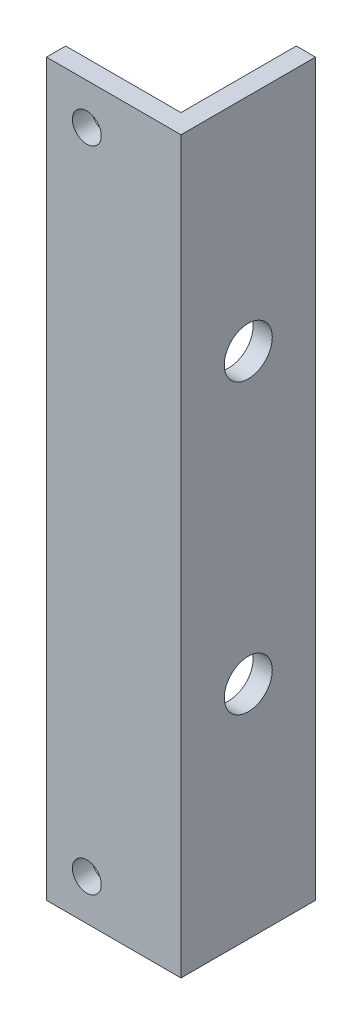
from build123d import *

# Parameters (mm, degrees)
EXTRUDE_1_DEPTH     = 76
SKETCH_2_R          = 1.5
CUT_EXTRUDE_1_DEPTH = 76
SKETCH_3_R          = 2.5
CUT_EXTRUDE_2_DEPTH = 76


with BuildPart() as part:
    # 草图1 → 凸台-拉伸1 (new body)
    with BuildSketch(Plane(origin=(0, 0, 0), x_dir=(1, 0, 0), z_dir=(0, 1, 0))):
        Polygon((0, 0), (14, 0), (14, 14), (12, 14), (12, 2), (0, 2), align=None)
    extrude(amount=EXTRUDE_1_DEPTH)

    # 草图2 → 切除-拉伸1 (cut)
    with BuildSketch(Plane.XY):
        with Locations((4.2, 4.25)):
            Circle(SKETCH_2_R)
        with Locations((4.2, 71.75)):
            Circle(SKETCH_2_R)
    extrude(amount=-CUT_EXTRUDE_1_DEPTH, mode=Mode.SUBTRACT)

    # 草图3 → 切除-拉伸2 (cut)
    with BuildSketch(Plane(origin=(14, 0, 0), x_dir=(0, 0, -1), z_dir=(1, 0, 0))):
        with Locations((7, 23)):
            Circle(SKETCH_3_R)
        with Locations((7, 53)):
            Circle(SKETCH_3_R)
    extrude(amount=-CUT_EXTRUDE_2_DEPTH, mode=Mode.SUBTRACT)


solid = part.part
